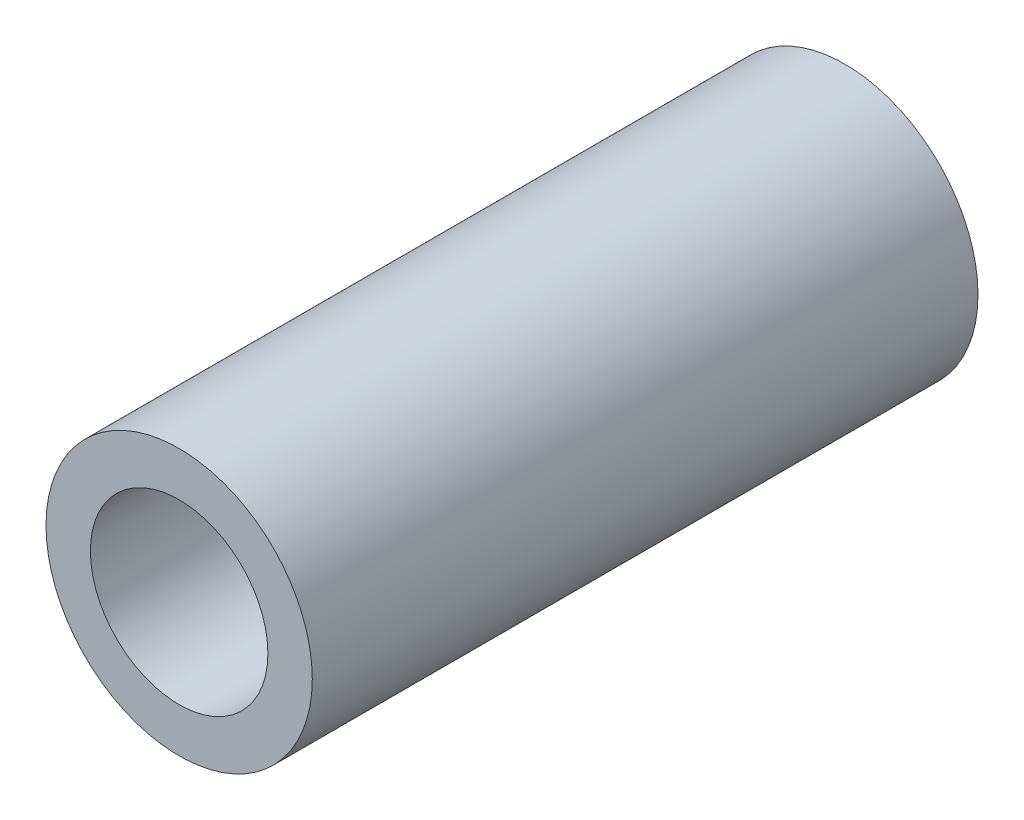
from build123d import *

# Parameters (mm, degrees)
SKETCH_1_R      = 3
SKETCH_1_R_2    = 2
EXTRUDE_1_DEPTH = 7.5


with BuildPart() as part:
    # 草图1 → 凸台-拉伸1 (new, symmetric)
    with BuildSketch(Plane.XY):
        Circle(SKETCH_1_R)
        Circle(SKETCH_1_R_2, mode=Mode.SUBTRACT)
    extrude(amount=EXTRUDE_1_DEPTH, both=True)


solid = part.part
